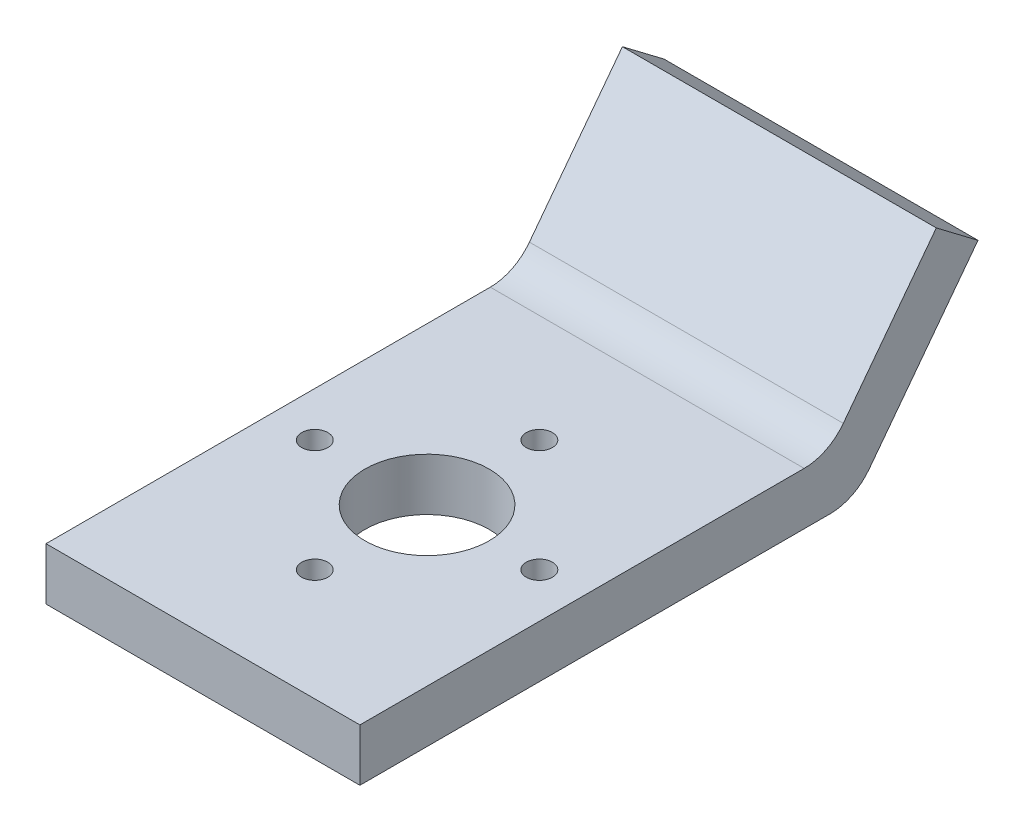
from build123d import *

# Parameters (mm, degrees)
EXTRUDE1_DEPTH = 38.1
SKETCH2_R      = 7.543563031
SKETCH2_R_2    = 1.586948076
EXTRUDE2_DEPTH = 38.1


with BuildPart() as part:
    # Sketch1 → Extrude1 (new body)
    with BuildSketch(Plane(origin=(0, 0, 0), x_dir=(0, 0, -1), z_dir=(1, 0, 0))):
        with BuildLine():
            Line((34.023739696, 28.939470853), (91.107488572, 28.939470853))
            ThreePointArc((91.107488572, 28.939470853), (93.758821762, 29.562065849), (95.855917312, 31.299702884))
            Line((95.855917312, 31.299702884), (109.047015974, 48.716075337))
            Line((109.047015974, 48.716075337), (103.985043986, 52.54999495))
            Line((103.985043986, 52.54999495), (92.699615676, 37.649702884))
            ThreePointArc((92.699615676, 37.649702884), (90.602520127, 35.912065849), (87.951186937, 35.289470853))
            Line((87.951186937, 35.289470853), (34.023739696, 35.289470853))
            Line((34.023739696, 35.289470853), (34.023739696, 28.939470853))
        make_face()
    extrude(amount=-EXTRUDE1_DEPTH)

    # Sketch2 → Extrude2 (cut)
    with BuildSketch(Plane(origin=(0, 0, 0), x_dir=(1, 0, 0), z_dir=(0, 1, 0))):
        with Locations(Location((-19.05, 61.225007573, 0), (0, 0, 90))):
            Circle(SKETCH2_R)
        with Locations(Location((-32.67765431, 61.225007573, 0), (0, 0, 90))):
            Circle(SKETCH2_R_2)
        with Locations(Location((-19.05, 74.852661883, 0), (0, 0, 90))):
            Circle(SKETCH2_R_2)
        with Locations(Location((-5.42234569, 61.225007573, 0), (0, 0, 90))):
            Circle(SKETCH2_R_2)
        with Locations(Location((-19.05, 47.597353263, 0), (0, 0, 90))):
            Circle(SKETCH2_R_2)
    extrude(amount=EXTRUDE2_DEPTH, mode=Mode.SUBTRACT)


solid = part.part
